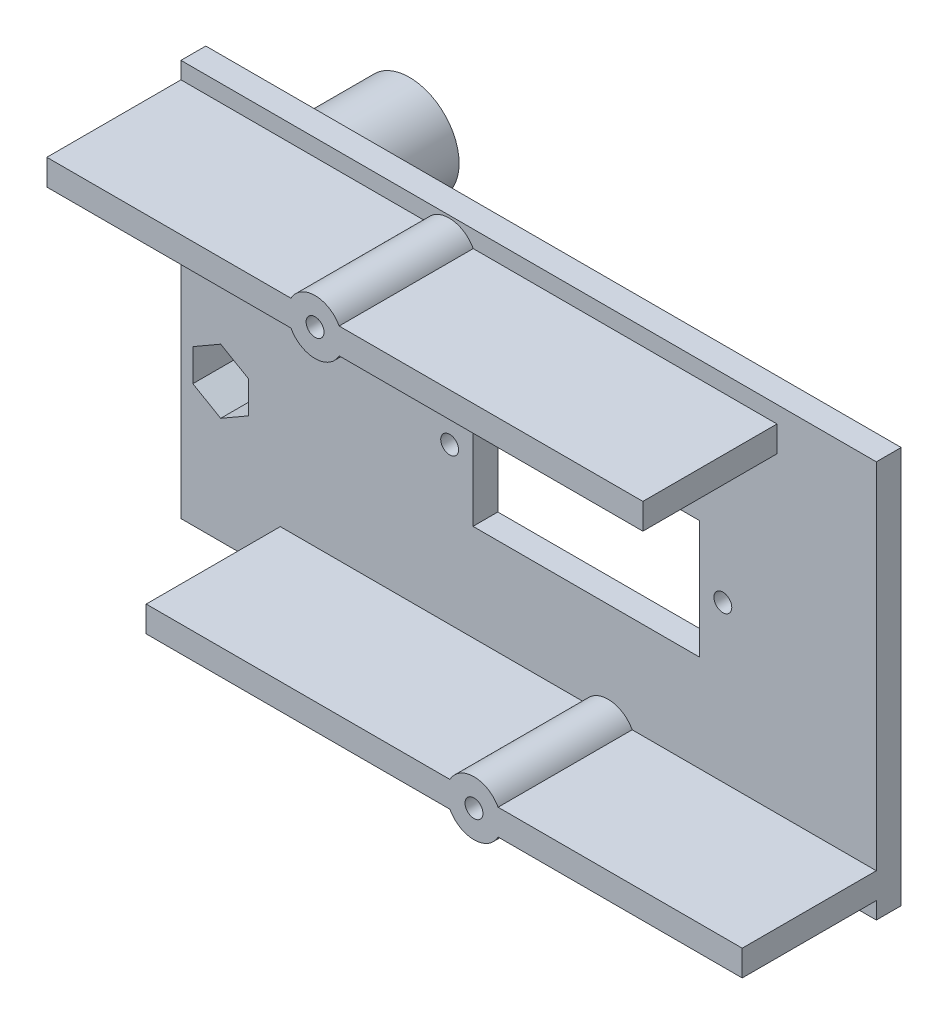
from build123d import *

# Parameters (mm, degrees)
BOSS_EXTRUDE1_START     = -2.5
SKETCH1_W               = 70
SKETCH1_H               = 39.95
BOSS_EXTRUDE1_DEPTH     = 2.5
SKETCH2_W               = 60
SKETCH2_H               = 2.6
BOSS_EXTRUDE2_DEPTH     = 13.5
SKETCH3_W               = 60
SKETCH3_H               = 2.6
BOSS_EXTRUDE3_DEPTH     = 13.5
SKETCH4_R               = 2.75
BOSS_EXTRUDE4_DEPTH     = 13.5
BOSS_EXTRUDE5_START     = -19
SKETCH5_R               = 5
BOSS_EXTRUDE5_DEPTH     = 16.5
CUT_EXTRUDE1_DEPTH      = 46.343143087
CUT_EXTRUDE1_DEPTH_BACK = 46.343143087
SKETCH6_W               = 22.8
SKETCH6_H               = 11.9
CUT_EXTRUDE2_DEPTH      = 46.343143087
CUT_EXTRUDE2_DEPTH_BACK = 46.343143087
SKETCH7_R               = 0.9
CUT_EXTRUDE3_DEPTH      = 46.343143087
CUT_EXTRUDE3_DEPTH_BACK = 46.343143087
SKETCH8_R               = 0.9
CUT_EXTRUDE4_DEPTH      = 46.343143087
CUT_EXTRUDE4_DEPTH_BACK = 46.343143087
SKETCH9_R               = 1.725
CUT_EXTRUDE5_START      = -4.2
CUT_EXTRUDE5_DEPTH      = 4.2


with BuildPart() as part:
    # Sketch1 → Boss-Extrude1 (new body)
    with BuildSketch(Plane.XY.offset(BOSS_EXTRUDE1_START)):
        Rectangle(SKETCH1_W, SKETCH1_H)
    extrude(amount=BOSS_EXTRUDE1_DEPTH)

    # Sketch2 → Boss-Extrude2 (add)
    with BuildSketch(Plane.XY):
        with Locations((-5, 16.975)):
            Rectangle(SKETCH2_W, SKETCH2_H)
    extrude(amount=BOSS_EXTRUDE2_DEPTH)

    # Sketch3 → Boss-Extrude3 (add)
    with BuildSketch(Plane.XY):
        with Locations((5, -16.975)):
            Rectangle(SKETCH3_W, SKETCH3_H)
    extrude(amount=BOSS_EXTRUDE3_DEPTH)

    # Sketch4 → Boss-Extrude4 (add)
    with BuildSketch(Plane.XY):
        with Locations((-8, 16.975)):
            Circle(SKETCH4_R)
        with Locations((8, -16.975)):
            Circle(SKETCH4_R)
    extrude(amount=BOSS_EXTRUDE4_DEPTH)

    # Sketch5 → Boss-Extrude5 (add)
    with BuildSketch(Plane.XY.offset(BOSS_EXTRUDE5_START)):
        with Locations(Location((-31, 6, 0), (0, 0, 143.130102354))):
            Circle(SKETCH5_R)
        with Locations(Location((-31, -6, 0), (0, 0, 143.130102354))):
            Circle(SKETCH5_R)
    extrude(amount=BOSS_EXTRUDE5_DEPTH)

    # Sketch6 → Cut-Extrude1 (cut, two sides: drawn at the far end of the back side and taken through both)
    with BuildSketch(Plane.XY.offset(-CUT_EXTRUDE1_DEPTH_BACK)):
        with Locations((5.8, 0)):
            Rectangle(SKETCH6_W, SKETCH6_H)
    extrude(amount=CUT_EXTRUDE1_DEPTH + CUT_EXTRUDE1_DEPTH_BACK, mode=Mode.SUBTRACT)

    # Sketch7 → Cut-Extrude2 (cut, two sides: drawn at the far end of the back side and taken through both)
    with BuildSketch(Plane.XY.offset(-CUT_EXTRUDE2_DEPTH_BACK)):
        with Locations((-7.95, 0)):
            Circle(SKETCH7_R)
        with Locations((19.55, 0)):
            Circle(SKETCH7_R)
    extrude(amount=CUT_EXTRUDE2_DEPTH + CUT_EXTRUDE2_DEPTH_BACK, mode=Mode.SUBTRACT)

    # Sketch8 → Cut-Extrude3 (cut, two sides: drawn at the far end of the back side and taken through both)
    with BuildSketch(Plane.XY.offset(-CUT_EXTRUDE3_DEPTH_BACK)):
        with Locations((-8, 16.975)):
            Circle(SKETCH8_R)
        with Locations((8, -16.975)):
            Circle(SKETCH8_R)
    extrude(amount=CUT_EXTRUDE3_DEPTH + CUT_EXTRUDE3_DEPTH_BACK, mode=Mode.SUBTRACT)

    # Sketch9 → Cut-Extrude4 (cut, two sides: drawn at the far end of the back side and taken through both)
    with BuildSketch(Plane.XY.offset(-CUT_EXTRUDE4_DEPTH_BACK)):
        with Locations((-31, 6)):
            Circle(SKETCH9_R)
        with Locations((-31, -6)):
            Circle(SKETCH9_R)
    extrude(amount=CUT_EXTRUDE4_DEPTH + CUT_EXTRUDE4_DEPTH_BACK, mode=Mode.SUBTRACT)

    # Sketch10 → Cut-Extrude5 (cut)
    with BuildSketch(Plane.XY.offset(CUT_EXTRUDE5_START)):
        Polygon((-28.2, 7.616580754), (-31, 9.233161507), (-33.8, 7.616580754), (-33.8, 4.383419246), (-31, 2.766838493), (-28.2, 4.383419246), align=None)
        Polygon((-28.2, -4.383419246), (-31, -2.766838493), (-33.8, -4.383419246), (-33.8, -7.616580754), (-31, -9.233161507), (-28.2, -7.616580754), align=None)
    extrude(amount=CUT_EXTRUDE5_DEPTH, mode=Mode.SUBTRACT)


solid = part.part
